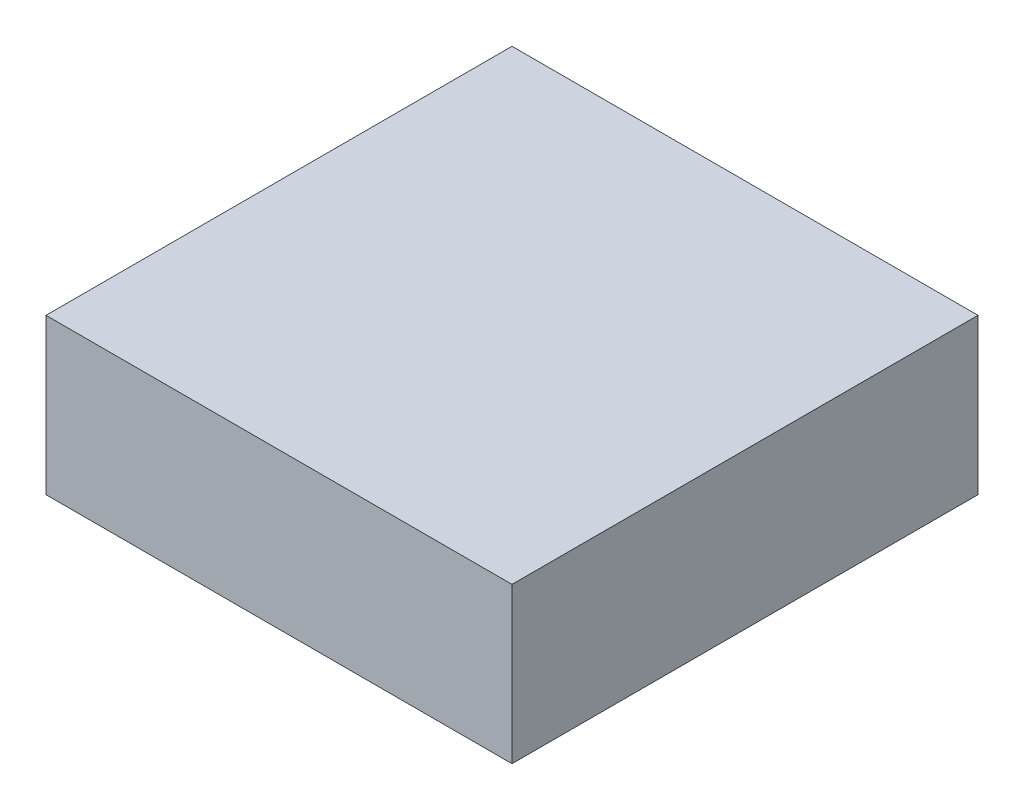
from build123d import *

# Parameters (mm, degrees)
SKETCH_1_W      = 150
SKETCH_1_H      = 150
EXTRUDE_1_DEPTH = 50


with BuildPart() as part:
    # Эскиз1 → Бобышка-Вытянуть1 (new body)
    with BuildSketch(Plane(origin=(0, 0, 0), x_dir=(1, 0, 0), z_dir=(0, 1, 0))):
        with Locations((75, 75)):
            Rectangle(SKETCH_1_W, SKETCH_1_H)
    extrude(amount=EXTRUDE_1_DEPTH)


solid = part.part
